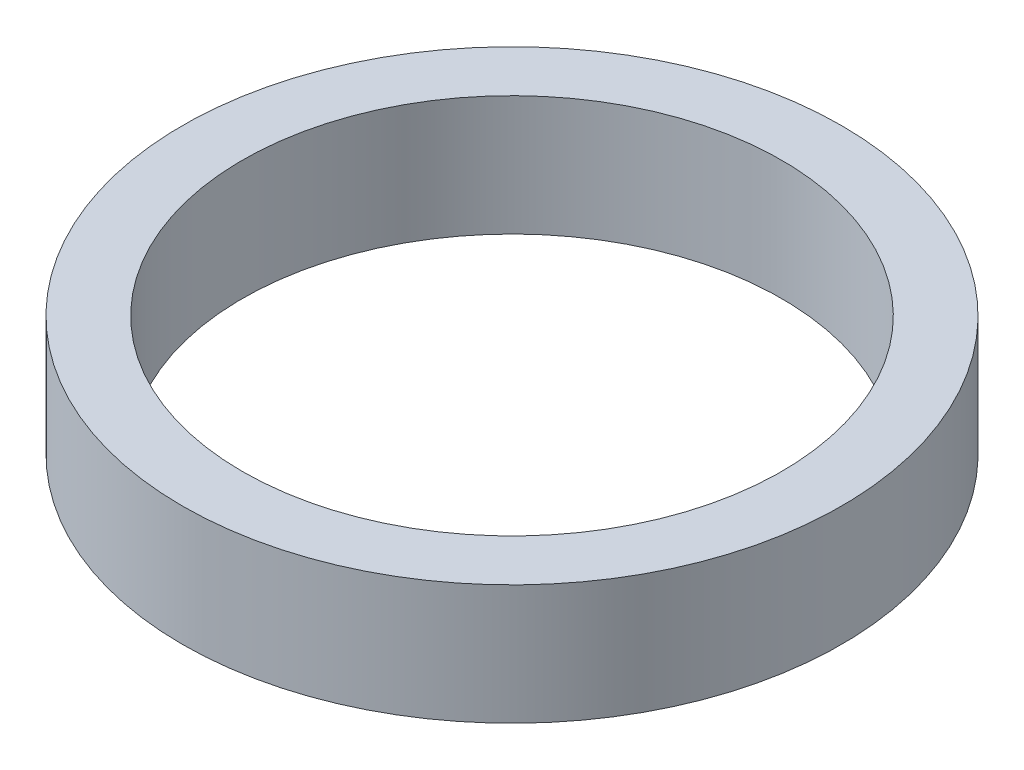
from build123d import *

# Parameters (mm, degrees)
SKETCH1_R           = 13.97
BOSS_EXTRUDE1_DEPTH = 5.08
SKETCH2_R           = 11.43
CUT_EXTRUDE1_DEPTH  = 5.08


with BuildPart() as part:
    # Sketch1 → Boss-Extrude1 (new body)
    with BuildSketch(Plane(origin=(0, 0, 0), x_dir=(1, 0, 0), z_dir=(0, 1, 0))):
        with Locations(Location((0, 0, 0), (0, 0, 270))):
            Circle(SKETCH1_R)
    extrude(amount=BOSS_EXTRUDE1_DEPTH)

    # Sketch2 → Cut-Extrude1 (cut)
    with BuildSketch(Plane(origin=(0, 5.08, 0), x_dir=(1, 0, 0), z_dir=(0, 1, 0))):
        with Locations(Location((0, 0, 0), (0, 0, 270))):
            Circle(SKETCH2_R)
    extrude(amount=-CUT_EXTRUDE1_DEPTH, mode=Mode.SUBTRACT)


solid = part.part
